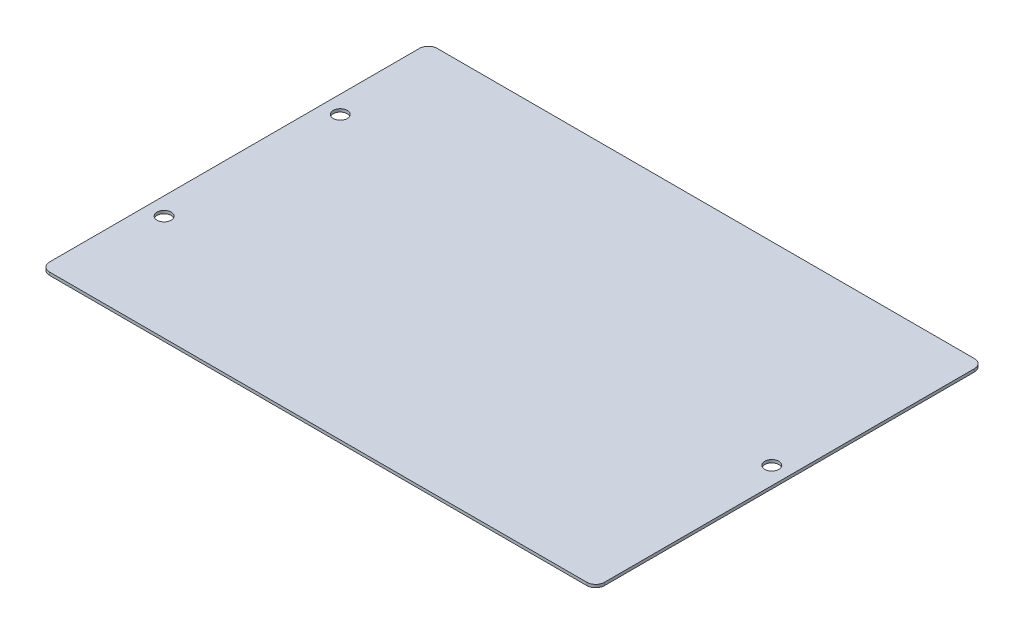
from build123d import *

# Parameters (mm, degrees)
SKETCH1_W           = 189
SKETCH1_H           = 132
BOSS_EXTRUDE1_DEPTH = 1
SKETCH3_R           = 2.4
CUT_EXTRUDE1_DEPTH  = 116.270334432
FILLET1_R           = 3


with BuildPart() as part:
    # Sketch1 → Boss-Extrude1 (new body)
    with BuildSketch(Plane(origin=(0, 0, 0), x_dir=(1, 0, 0), z_dir=(0, 1, 0))):
        Rectangle(SKETCH1_W, SKETCH1_H)
    extrude(amount=BOSS_EXTRUDE1_DEPTH)

    # Sketch3 → Cut-Extrude1 (cut, through all)
    with BuildSketch(Plane(origin=(0, 1, 0), x_dir=(1, 0, 0), z_dir=(0, 1, 0))):
        with Locations(Location((88.5, 0, 0), (0, 0, 270))):
            Circle(SKETCH3_R)
        with Locations(Location((-88.5, -30, 0), (0, 0, 270))):
            Circle(SKETCH3_R)
        with Locations(Location((-88.5, 30, 0), (0, 0, 270))):
            Circle(SKETCH3_R)
    extrude(amount=-CUT_EXTRUDE1_DEPTH, mode=Mode.SUBTRACT)

    # Fillet1
    fillet1_edges = [part.edges().sort_by_distance(p)[0] for p in [
        (94.5, 0.5, 66),
        (-94.5, 0.5, 66),
        (-94.5, 0.5, -66),
        (94.5, 0.5, -66),
    ]]
    fillet(fillet1_edges, radius=FILLET1_R)


solid = part.part
